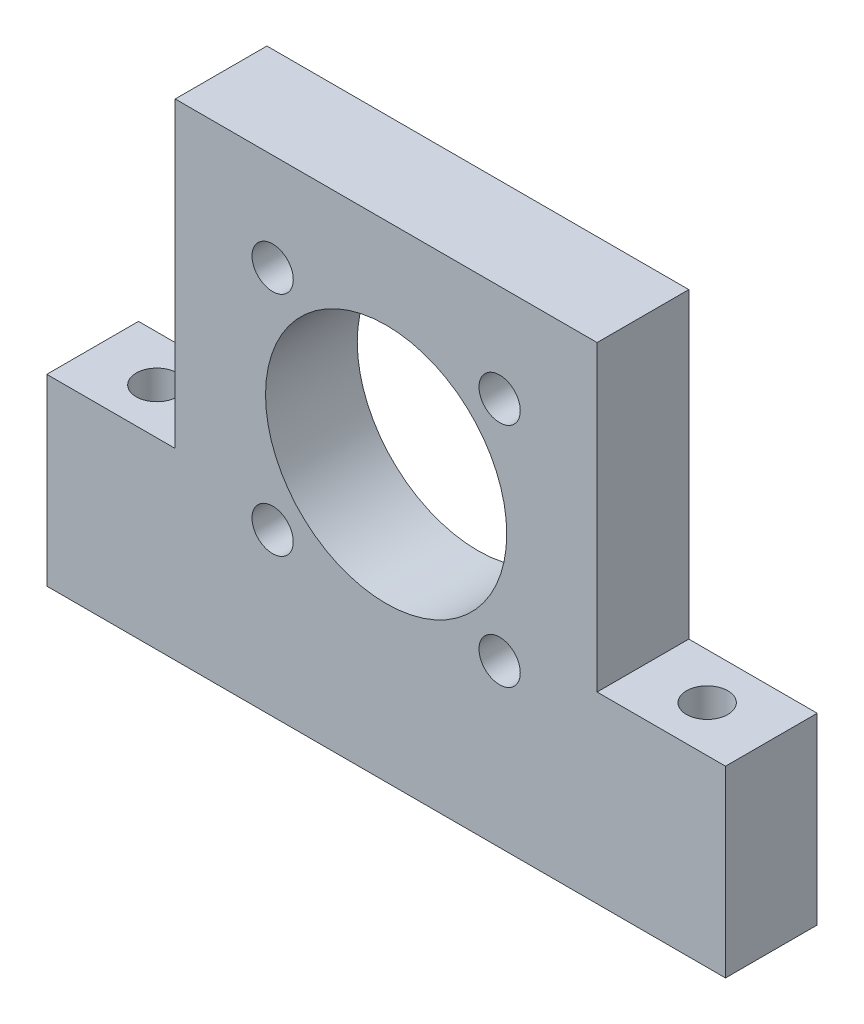
from build123d import *

# Parameters (mm, degrees)
ESQUISSE1_R             = 13.15
BOSS_EXTRU_1_DEPTH      = 10
ENL_V_MAT_EXTRU_2_REACH = 67.406
ESQUISSE5_R             = 2.25
SKETCH1_R               = 2.25
CUT_EXTRUDE1_DEPTH      = 49.672374095
CIRPATTERN1_COUNT       = 4


with BuildPart() as part:
    # Esquisse1 → Boss.-Extru.1 (new body)
    with BuildSketch(Plane.XY):
        Polygon((-23, 23), (23, 23), (23, -10), (37, -10), (37, -30), (-37, -30), (-37, -10), (-23, -10), align=None)
        Circle(ESQUISSE1_R, mode=Mode.SUBTRACT)
    extrude(amount=BOSS_EXTRU_1_DEPTH)

    # Esquisse5 → Enlèv. mat.-Extru.2 (cut, up to next)
    with BuildSketch(Plane.XZ.offset(30), mode=Mode.PRIVATE) as enl_v_mat_extru_2_sk1:
        with Locations(Location((-30, 5, 0), (0, 0, 270))):
            Circle(ESQUISSE5_R)
    enl_v_mat_extru_2_tool1 = extrude(enl_v_mat_extru_2_sk1.sketch, amount=-ENL_V_MAT_EXTRU_2_REACH, mode=Mode.PRIVATE) & part.part
    # Esquisse5 → Enlèv. mat.-Extru.2 (cut, up to next)
    with BuildSketch(Plane.XZ.offset(30), mode=Mode.PRIVATE) as enl_v_mat_extru_2_sk2:
        with Locations(Location((30, 5, 0), (0, 0, 270))):
            Circle(ESQUISSE5_R)
    enl_v_mat_extru_2_tool2 = extrude(enl_v_mat_extru_2_sk2.sketch, amount=-ENL_V_MAT_EXTRU_2_REACH, mode=Mode.PRIVATE) & part.part
    add(enl_v_mat_extru_2_tool1.solids().sort_by_distance((-30, -30, 5))[0], mode=Mode.SUBTRACT)
    add(enl_v_mat_extru_2_tool2.solids().sort_by_distance((30, -30, 5))[0], mode=Mode.SUBTRACT)

    # Sketch1 → Cut-Extrude1 (cut, through all)
    with BuildSketch(Plane.XY.offset(10)):
        with Locations((12.374368671, 12.374368671)):
            Circle(SKETCH1_R)
    cut_extrude1 = extrude(amount=-CUT_EXTRUDE1_DEPTH, mode=Mode.SUBTRACT)

    # CirPattern1: Cut-Extrude1 ×4 about axis
    cirpattern1_axis = Axis((0, 0, 0), (0, 0, 1))
    for i in range(1, CIRPATTERN1_COUNT):
        add(cut_extrude1.rotate(cirpattern1_axis, i * 360 / CIRPATTERN1_COUNT), mode=Mode.SUBTRACT)


solid = part.part
